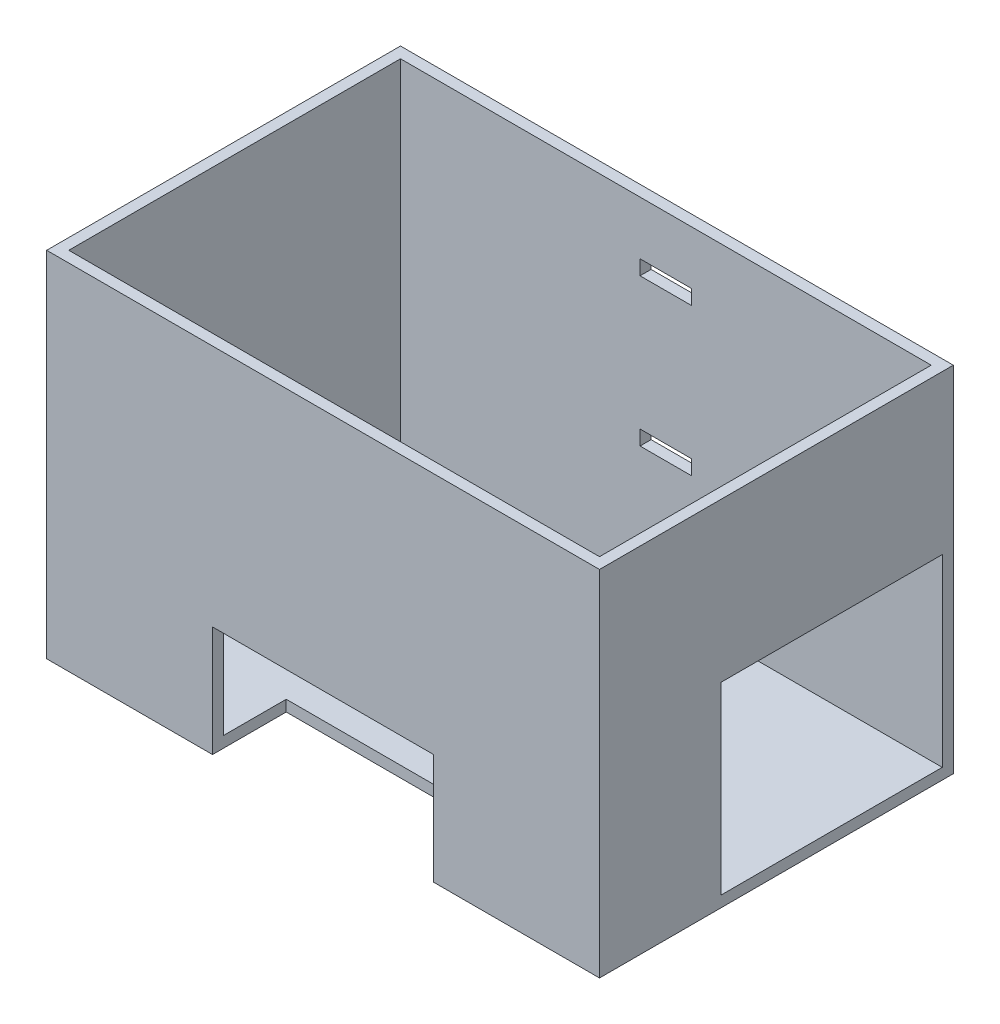
from build123d import *

# Parameters (mm, degrees)
SKETCH1_W           = 75
SKETCH1_H           = 48
BOSS_EXTRUDE1_DEPTH = 48
SHELL1_T            = -1.5
SKETCH2_W           = 30
SKETCH2_H           = 25
CUT_EXTRUDE2_DEPTH  = 50
SKETCH3_W           = 30
SKETCH3_H           = 10
CUT_EXTRUDE3_DEPTH  = 15
SKETCH4_W           = 20
SKETCH4_H           = 25
CUT_EXTRUDE4_DEPTH  = 15
SKETCH5_W           = 7
SKETCH5_H           = 2
CUT_EXTRUDE5_DEPTH  = 15


with BuildPart() as part:
    # Sketch1 → Boss-Extrude1 (new body)
    with BuildSketch(Plane(origin=(0, 0, 0), x_dir=(1, 0, 0), z_dir=(0, 1, 0))):
        with Locations((37.5, 24)):
            Rectangle(SKETCH1_W, SKETCH1_H)
    extrude(amount=BOSS_EXTRUDE1_DEPTH)

    # Shell1
    shell1_openings = [part.faces().sort_by_distance(p)[0] for p in [
        (37.5, 48, -24),
    ]]
    offset(amount=SHELL1_T, openings=shell1_openings, kind=Kind.INTERSECTION)

    # Sketch2 → Cut-Extrude2 (cut)
    with BuildSketch(Plane(origin=(75, 0, 0), x_dir=(0, 0, -1), z_dir=(1, 0, 0))):
        with Locations((31.5, 14)):
            Rectangle(SKETCH2_W, SKETCH2_H)
    extrude(amount=-CUT_EXTRUDE2_DEPTH, mode=Mode.SUBTRACT)

    # Sketch3 → Cut-Extrude3 (cut)
    with BuildSketch(Plane.XZ):
        with Locations((37.5, -5)):
            Rectangle(SKETCH3_W, SKETCH3_H)
    extrude(amount=-CUT_EXTRUDE3_DEPTH, mode=Mode.SUBTRACT)

    # Sketch4 → Cut-Extrude4 (cut)
    with BuildSketch(Plane.ZY):
        with Locations((-11.5, 14)):
            Rectangle(SKETCH4_W, SKETCH4_H)
    extrude(amount=-CUT_EXTRUDE4_DEPTH, mode=Mode.SUBTRACT)

    # Sketch5 → Cut-Extrude5 (cut)
    with BuildSketch(Plane(origin=(0, 0, -48), x_dir=(-1, 0, 0), z_dir=(0, 0, -1))):
        with Locations((-37.5, 19.75)):
            Rectangle(SKETCH5_W, SKETCH5_H)
        with Locations((-37.5, 39.75)):
            Rectangle(SKETCH5_W, SKETCH5_H)
    extrude(amount=-CUT_EXTRUDE5_DEPTH, mode=Mode.SUBTRACT)


solid = part.part
